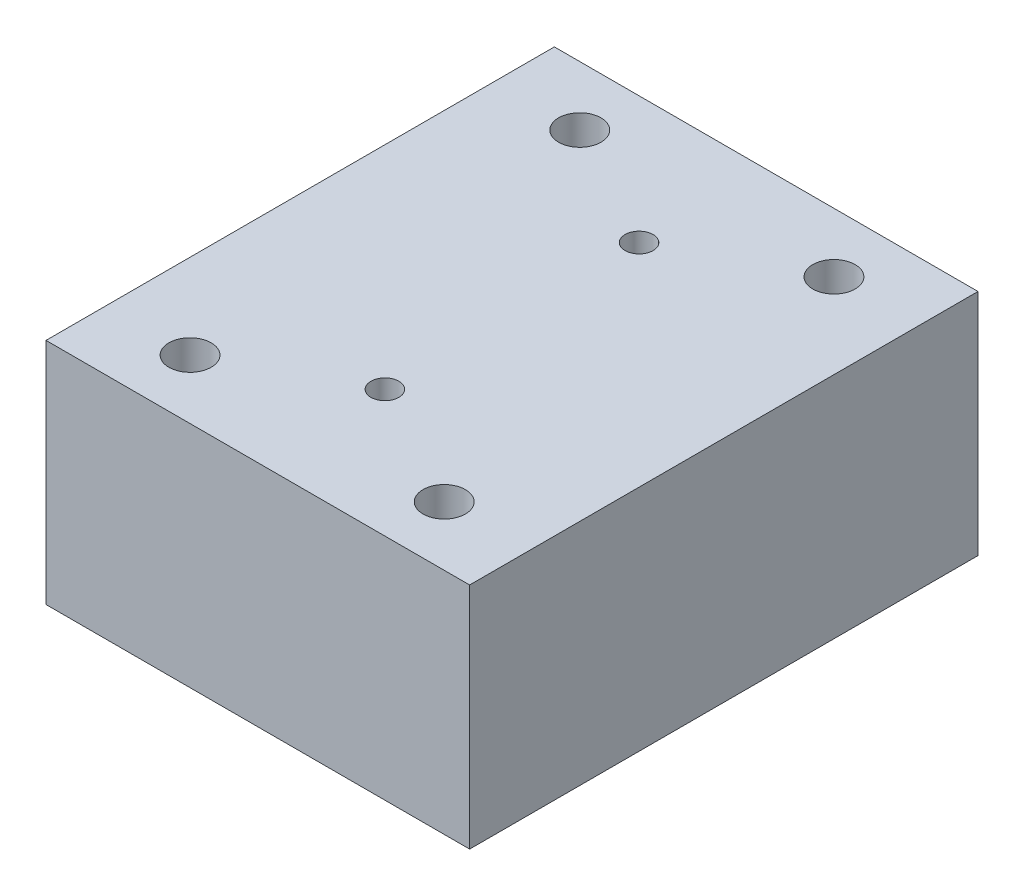
from build123d import *

# Parameters (mm, degrees)
SKETCH_1_W             = 50
SKETCH_1_H             = 27
EXTRUDE_1_DEPTH        = 60
SKETCH_2_R             = 2.5
CUT_EXTRUDE_1_DEPTH    = 27
PATTERN_LINEAR_1_COUNT = 2
PATTERN_LINEAR_1_PITCH = 46
SKETCH_3_R             = 2.5
CUT_EXTRUDE_2_DEPTH    = 27
PATTERN_LINEAR_2_COUNT = 2
PATTERN_LINEAR_2_PITCH = 46
SKETCH_4_R             = 1.65
CUT_EXTRUDE_3_DEPTH    = 27


with BuildPart() as part:
    # Эскиз1 → Бобышка-Вытянуть1 (new body)
    with BuildSketch(Plane.XY):
        Rectangle(SKETCH_1_W, SKETCH_1_H)
    extrude(amount=EXTRUDE_1_DEPTH)

    # Эскиз2 → Вырез-Вытянуть1 (cut)
    with BuildSketch(Plane(origin=(0, 13.5, 0), x_dir=(1, 0, 0), z_dir=(0, 1, 0))):
        with Locations(Location((-15, -7, 0), (0, 0, 180))):
            Circle(SKETCH_2_R)
    cut_extrude_1 = extrude(amount=-CUT_EXTRUDE_1_DEPTH, mode=Mode.SUBTRACT)

    # Линейный массив1: Вырез-Вытянуть1 ×2
    with Locations(*[(0, 0, i * PATTERN_LINEAR_1_PITCH) for i in range(1, PATTERN_LINEAR_1_COUNT)]):
        add(cut_extrude_1, mode=Mode.SUBTRACT)

    # Эскиз3 → Вырез-Вытянуть2 (cut)
    with BuildSketch(Plane(origin=(0, 13.5, 0), x_dir=(1, 0, 0), z_dir=(0, 1, 0))):
        with Locations(Location((15, -7, 0), (0, 0, 180))):
            Circle(SKETCH_3_R)
    cut_extrude_2 = extrude(amount=-CUT_EXTRUDE_2_DEPTH, mode=Mode.SUBTRACT)

    # Линейный массив2: Вырез-Вытянуть2 ×2
    with Locations(*[(0, 0, i * PATTERN_LINEAR_2_PITCH) for i in range(1, PATTERN_LINEAR_2_COUNT)]):
        add(cut_extrude_2, mode=Mode.SUBTRACT)

    # Эскиз4 → Вырез-Вытянуть3 (cut)
    with BuildSketch(Plane(origin=(0, 13.5, 0), x_dir=(1, 0, 0), z_dir=(0, 1, 0))):
        with Locations(Location((0, -15, 0), (0, 0, 270))):
            Circle(SKETCH_4_R)
        with Locations(Location((0, -45, 0), (0, 0, 270))):
            Circle(SKETCH_4_R)
    extrude(amount=-CUT_EXTRUDE_3_DEPTH, mode=Mode.SUBTRACT)


solid = part.part
